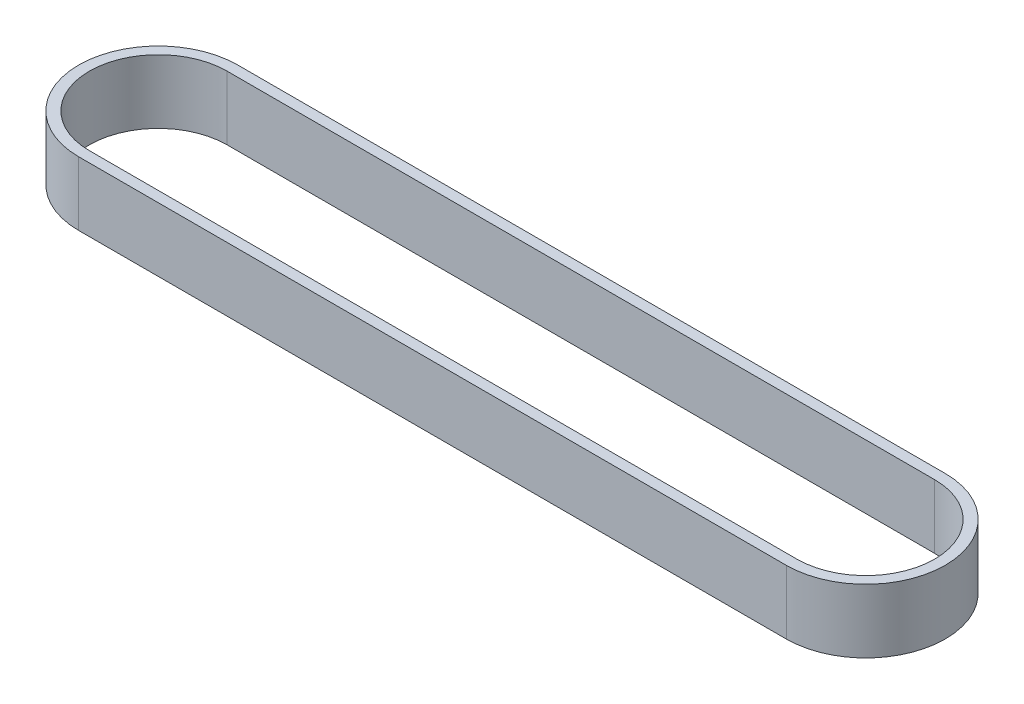
from build123d import *

# Parameters (mm, degrees)
EXTRUDE_1_DEPTH = 6


with BuildPart() as part:
    # 草图1 → 凸台-拉伸1 (new body)
    with BuildSketch(Plane(origin=(0, 0, 0), x_dir=(1, 0, 0), z_dir=(0, 1, 0))):
        with BuildLine():
            Line((-33.24, 7.47), (33.24, 7.47))
            ThreePointArc((33.24, 7.47), (40.71, 0), (33.24, -7.47))
            Line((33.24, -7.47), (-33.24, -7.47))
            ThreePointArc((-33.24, -7.47), (-40.71, 0), (-33.24, 7.47))
        make_face()
        with BuildLine():
            Line((-33.24, 6.47), (33.24, 6.47))
            ThreePointArc((33.24, 6.47), (39.71, 0), (33.24, -6.47))
            Line((33.24, -6.47), (-33.24, -6.47))
            ThreePointArc((-33.24, -6.47), (-39.71, 0), (-33.24, 6.47))
        make_face(mode=Mode.SUBTRACT)
    extrude(amount=EXTRUDE_1_DEPTH)


solid = part.part
